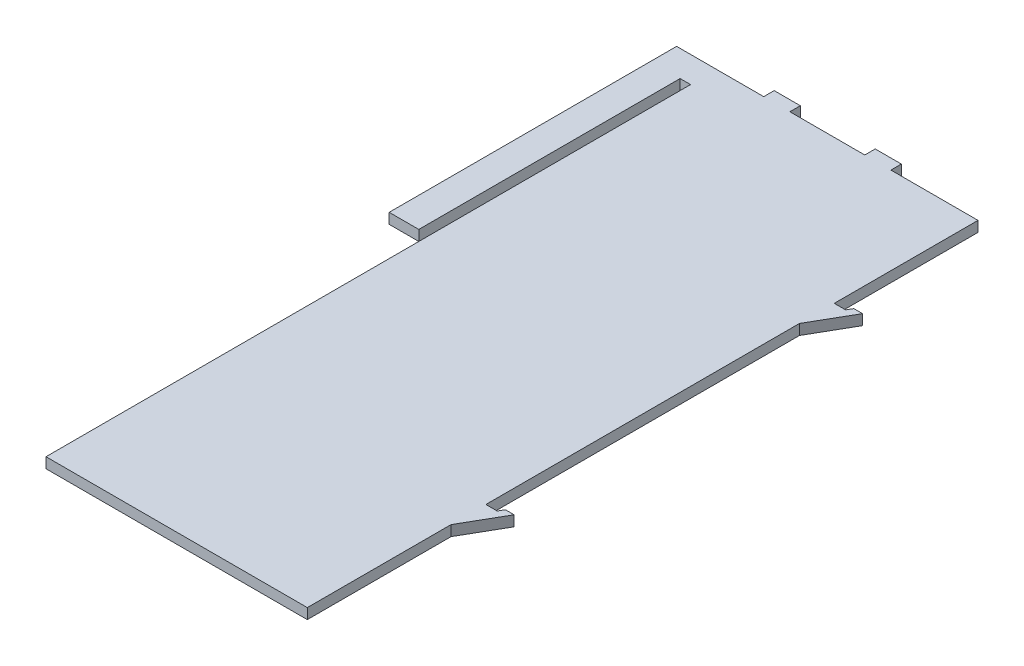
from build123d import *

# Parameters (mm, degrees)
BOSS_EXTRUDE1_DEPTH = 6


with BuildPart() as part:
    # Sketch1 → Boss-Extrude1 (new body)
    with BuildSketch(Plane(origin=(0, 0, 0), x_dir=(1, 0, 0), z_dir=(0, 1, 0))):
        Polygon((0, 0), (0, 165), (50, 165), (50, 171), (65, 171), (65, 165), (108, 165), (108, 171), (123, 171), (123, 165), (173, 165), (173, 82.5), (179.5, 82.5), (181.225, 85.5), (186.225, 85.5), (173, 62.5), (173, -117.5), (179.5, -117.5), (181.225, -114.5), (186.225, -114.5), (173, -137.5), (173, -220), (23, -220), (23, 150), (17, 150), (17, 0), align=None)
    extrude(amount=BOSS_EXTRUDE1_DEPTH)


solid = part.part
